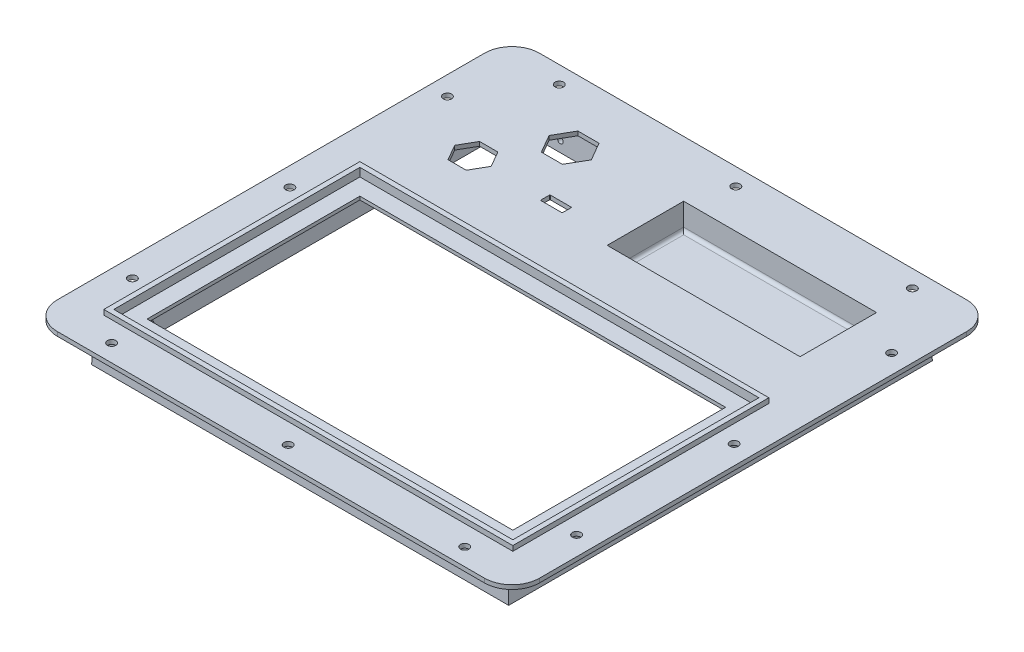
from build123d import *

# Parameters (mm, degrees)
SKETCH1_W           = 246
SKETCH1_H           = 154
BOSS_EXTRUDE1_DEPTH = 7
SKETCH2_W           = 240
SKETCH2_H           = 148
CUT_EXTRUDE1_DEPTH  = 5
SKETCH3_W           = 220
SKETCH3_H           = 128
CUT_EXTRUDE2_DEPTH  = 5
BOSS_EXTRUDE2_START = -3
SKETCH6_W           = 246
SKETCH6_H           = 154
BOSS_EXTRUDE2_DEPTH = 2.5
SKETCH8_W           = 39
SKETCH8_H           = 0.3
SKETCH8_W_2         = 12.26
CUT_EXTRUDE5_DEPTH  = 5
SKETCH9_R           = 0.5
CUT_EXTRUDE6_DEPTH  = 5
SKETCH10_R          = 2.54
CUT_EXTRUDE7_DEPTH  = 5
SKETCH11_W          = 249.3
SKETCH11_H          = 253.3
SKETCH11_W_2        = 245.3
SKETCH11_H_2        = 249.3
BOSS_EXTRUDE3_DEPTH = 22
BOSS_EXTRUDE3_DRAFT = -2
SKETCH12_R          = 1.7
CUT_EXTRUDE8_DEPTH  = 332.406096652
SKETCH13_R          = 1.7
CUT_EXTRUDE9_DEPTH  = 310.160818194
SKETCH14_W          = 120
SKETCH14_H          = 50
BOSS_EXTRUDE4_DEPTH = 15
CUT_EXTRUDE10_START = -2
SKETCH15_W          = 116
SKETCH15_H          = 46
CUT_EXTRUDE10_DEPTH = 239.282125844
FILLET1_R           = 2
CUT_EXTRUDE11_DEPTH = 241.656394056


with BuildPart() as part:
    # Sketch1 → Boss-Extrude1 (new body)
    with BuildSketch(Plane(origin=(0, 0, 0), x_dir=(1, 0, 0), z_dir=(0, 1, 0))):
        Rectangle(SKETCH1_W, SKETCH1_H)
    extrude(amount=-BOSS_EXTRUDE1_DEPTH)

    # Sketch2 → Cut-Extrude1 (cut)
    with BuildSketch(Plane(origin=(0, 0, 0), x_dir=(1, 0, 0), z_dir=(0, 1, 0))):
        Rectangle(SKETCH2_W, SKETCH2_H)
    extrude(amount=-CUT_EXTRUDE1_DEPTH, mode=Mode.SUBTRACT)

    # Sketch3 → Cut-Extrude2 (cut)
    with BuildSketch(Plane(origin=(0, -5, 0), x_dir=(1, 0, 0), z_dir=(0, 1, 0))):
        Rectangle(SKETCH3_W, SKETCH3_H)
    extrude(amount=-CUT_EXTRUDE2_DEPTH, mode=Mode.SUBTRACT)

    # Sketch6 → Boss-Extrude2 (add)
    with BuildSketch(Plane(origin=(0, 0, 0), x_dir=(1, 0, 0), z_dir=(0, 1, 0)).offset(BOSS_EXTRUDE2_START)):
        with BuildLine():
            Line((-128.49, -99.5), (128.49, -99.5))
            ThreePointArc((128.49, -99.5), (140.164332957, -94.664332957), (145, -82.99))
            Line((145, -82.99), (145, 173.99))
            ThreePointArc((145, 173.99), (140.164332957, 185.664332957), (128.49, 190.5))
            Line((128.49, 190.5), (-128.49, 190.5))
            ThreePointArc((-128.49, 190.5), (-140.164332957, 185.664332957), (-145, 173.99))
            Line((-145, 173.99), (-145, -82.99))
            ThreePointArc((-145, -82.99), (-140.164332957, -94.664332957), (-128.49, -99.5))
        make_face()
        Rectangle(SKETCH6_W, SKETCH6_H, mode=Mode.SUBTRACT)
    extrude(amount=-BOSS_EXTRUDE2_DEPTH)

    # Sketch8 → Cut-Extrude5 (cut)
    with BuildSketch(Plane(origin=(0, -5, 0), x_dir=(1, 0, 0), z_dir=(0, 1, 0))):
        with Locations((0.5, -72.95)):
            Rectangle(SKETCH8_W, SKETCH8_H)
        with Locations((-36.13, -72.95)):
            Rectangle(SKETCH8_W_2, SKETCH8_H)
    extrude(amount=-CUT_EXTRUDE5_DEPTH, mode=Mode.SUBTRACT)

    # Sketch9 → Cut-Extrude6 (cut)
    with BuildSketch(Plane(origin=(0, -5, 0), x_dir=(1, 0, 0), z_dir=(0, 1, 0))):
        with Locations(Location((119, -46.2, 0), (0, 0, 270))):
            Circle(SKETCH9_R)
        with Locations(Location((119, -42.7, 0), (0, 0, 270))):
            Circle(SKETCH9_R)
    extrude(amount=-CUT_EXTRUDE6_DEPTH, mode=Mode.SUBTRACT)

    # Sketch10 → Cut-Extrude7 (cut)
    with BuildSketch(Plane(origin=(0, -3, 0), x_dir=(1, 0, 0), z_dir=(0, 1, 0))):
        with Locations(Location((-133.604, 140.242, 0), (0, 0, 270))):
            Circle(SKETCH10_R)
        with Locations(Location((-106.172, 180.12, 0), (0, 0, 270))):
            Circle(SKETCH10_R)
        with Locations(Location((-133.604, -49.242, 0), (0, 0, 90))):
            Circle(SKETCH10_R)
        with Locations(Location((-133.604, 45.5, 0), (0, 0, 270))):
            Circle(SKETCH10_R)
        with Locations(Location((0, 180.12, 0), (0, 0, 270))):
            Circle(SKETCH10_R)
        with Locations(Location((0, -89.12, 0), (0, 0, 90))):
            Circle(SKETCH10_R)
        with Locations(Location((-106.172, -89.12, 0), (0, 0, 90))):
            Circle(SKETCH10_R)
        with Locations(Location((106.172, -89.12, 0), (0, 0, 270))):
            Circle(SKETCH10_R)
        with Locations(Location((133.604, 45.5, 0), (0, 0, 90))):
            Circle(SKETCH10_R)
        with Locations(Location((133.604, -49.242, 0), (0, 0, 270))):
            Circle(SKETCH10_R)
        with Locations(Location((106.172, 180.12, 0), (0, 0, 90))):
            Circle(SKETCH10_R)
        with Locations(Location((133.604, 140.242, 0), (0, 0, 90))):
            Circle(SKETCH10_R)
    extrude(amount=-CUT_EXTRUDE7_DEPTH, mode=Mode.SUBTRACT)


with BuildPart() as boss_extrude3_tool:
    # Sketch11 → Boss-Extrude3 (with draft: the straight prism first)
    with BuildSketch(Plane.XZ.offset(5.5)):
        with Locations((0, -45.5)):
            Rectangle(SKETCH11_W, SKETCH11_H)
        with Locations((0, -45.5)):
            Rectangle(SKETCH11_W_2, SKETCH11_H_2, mode=Mode.SUBTRACT)
    extrude(amount=BOSS_EXTRUDE3_DEPTH)
    # Boss-Extrude3: the draft: its side faces are tilted about the plane it starts from
    boss_extrude3_sides = [boss_extrude3_tool.faces().sort_by_distance(p)[0] for p in [
        (0, -16.5, -172.15),
        (124.65, -16.5, -45.5),
        (0, -16.5, 81.15),
        (-124.65, -16.5, -45.5),
        (0, -16.5, 79.15),
        (122.65, -16.5, -45.5),
        (0, -16.5, -170.15),
        (-122.65, -16.5, -45.5),
    ]]
    draft(boss_extrude3_sides, Plane.XZ.offset(5.5), BOSS_EXTRUDE3_DRAFT)


with BuildPart() as part_1:
    add(part.part)

    # Boss-Extrude3: add boss_extrude3_tool
    add(boss_extrude3_tool.part)

    # Sketch12 → Cut-Extrude8 (cut, through all)
    with BuildSketch(Plane(origin=(124.30634913, 4.340873364, 0), x_dir=(0, 0, -1), z_dir=(0.9993908270190958, 0.03489949670250105, 0))):
        with Locations(Location((-49.5, -16.860281787, 0), (0, 0, 90))):
            Circle(SKETCH12_R)
        with Locations(Location((140.5, -16.860281787, 0), (0, 0, 90))):
            Circle(SKETCH12_R)
    extrude(amount=-CUT_EXTRUDE8_DEPTH, mode=Mode.SUBTRACT)

    # Sketch13 → Cut-Extrude9 (cut, through all)
    with BuildSketch(Plane(origin=(0, 2.82367006, 80.859331036), x_dir=(1, 0, 0), z_dir=(0, 0.03489949670250106, 0.9993908270190958))):
        with Locations(Location((-95, -15.342153681, 0), (0, 0, 270))):
            Circle(SKETCH13_R)
        with Locations(Location((95, -15.342153681, 0), (0, 0, 90))):
            Circle(SKETCH13_R)
    extrude(amount=-CUT_EXTRUDE9_DEPTH, mode=Mode.SUBTRACT)

    # Sketch14 → Boss-Extrude4 (add)
    with BuildSketch(Plane.XZ.offset(5.5)):
        with Locations((50, -133.75)):
            Rectangle(SKETCH14_W, SKETCH14_H)
    extrude(amount=BOSS_EXTRUDE4_DEPTH)

    # Sketch15 → Cut-Extrude10 (cut, through all)
    with BuildSketch(Plane.XZ.offset(20.5).offset(CUT_EXTRUDE10_START)):
        with Locations((50, -133.75)):
            Rectangle(SKETCH15_W, SKETCH15_H)
    extrude(amount=-CUT_EXTRUDE10_DEPTH, mode=Mode.SUBTRACT)

    # Fillet1
    fillet1_edges = [part_1.edges().sort_by_distance(p)[0] for p in [
        (108, -18.5, -133.75),
        (50, -18.5, -110.75),
        (-8, -18.5, -133.75),
        (50, -18.5, -156.75),
    ]]
    fillet(fillet1_edges, radius=FILLET1_R)

    # Sketch16 → Cut-Extrude11 (cut, through all)
    with BuildSketch(Plane(origin=(0, -3, 0), x_dir=(1, 0, 0), z_dir=(0, 1, 0))):
        Polygon((-57.298294078, 150.5), (-63.649147039, 161.5), (-76.350852961, 161.5), (-82.701705922, 150.5), (-76.350852961, 139.5), (-63.649147039, 139.5), align=None)
        Polygon((-84.030344885, 117), (-89.515172443, 126.5), (-100.484827557, 126.5), (-105.969655115, 117), (-100.484827557, 107.5), (-89.515172443, 107.5), align=None)
        with BuildLine():
            Line((-51.23, 119.85), (-38.77, 119.85))
            ThreePointArc((-38.77, 119.85), (-38.550796898, 119.759203102), (-38.46, 119.54))
            Line((-38.46, 119.54), (-38.46, 114.46))
            ThreePointArc((-38.46, 114.46), (-38.550796898, 114.240796898), (-38.77, 114.15))
            Line((-38.77, 114.15), (-51.23, 114.15))
            ThreePointArc((-51.23, 114.15), (-51.449203102, 114.240796898), (-51.54, 114.46))
            Line((-51.54, 114.46), (-51.54, 119.54))
            ThreePointArc((-51.54, 119.54), (-51.449203102, 119.759203102), (-51.23, 119.85))
        make_face()
    extrude(amount=-CUT_EXTRUDE11_DEPTH, mode=Mode.SUBTRACT)


solid = part_1.part
